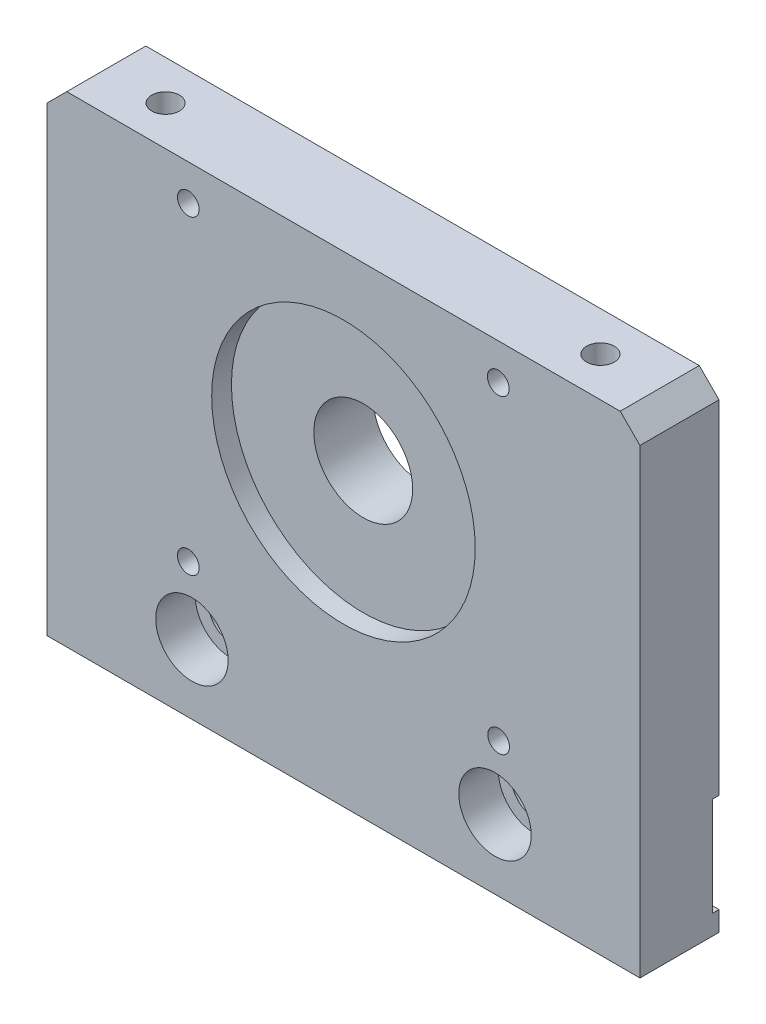
from build123d import *

# Parameters (mm, degrees)
SKETCH_1_W                   = 90
SKETCH_1_H                   = 73
EXTRUDE_1_DEPTH              = 12
SKETCH_2_R                   = 20
CUT_EXTRUDE_1_DEPTH          = 3
SKETCH_3_R                   = 7.5
CUT_EXTRUDE_2_DEPTH          = 117.232525568
CHAMFER_1_SIZE               = 3
SKETCH_4_W                   = 1
SKETCH_4_H                   = 15
CUT_EXTRUDE_3_DEPTH          = 117.50321884
HOLE_WIZARD_M6_1_D           = 7
HOLE_WIZARD_M6_1_CBORE_D     = 11
HOLE_WIZARD_M6_1_CBORE_DEPTH = 6
HOLE_WIZARD_M5_1_D           = 4.2
HOLE_WIZARD_M5_1_DEPTH       = 12.4
HOLE_WIZARD_M5_1_TIP         = 1.2618073
HOLE_WIZARD_M4_1_D           = 3.3
HOLE_WIZARD_M4_1_DEPTH       = 10.1
HOLE_WIZARD_M4_1_TIP         = 0.991420021
HOLE_WIZARD_M5_2_D           = 4.2
HOLE_WIZARD_M5_2_DEPTH       = 12.4
HOLE_WIZARD_M5_2_TIP         = 1.2618073


with BuildPart() as part:
    # 草图1 → 凸台-拉伸1 (new body)
    with BuildSketch(Plane.XY):
        with Locations((45, 36.5)):
            Rectangle(SKETCH_1_W, SKETCH_1_H)
    extrude(amount=EXTRUDE_1_DEPTH)

    # 草图2 → 切除-拉伸1 (cut)
    with BuildSketch(Plane.XY.offset(12)):
        with Locations((45, 44)):
            Circle(SKETCH_2_R)
    extrude(amount=-CUT_EXTRUDE_1_DEPTH, mode=Mode.SUBTRACT)

    # 草图3 → 切除-拉伸2 (cut, through all)
    with BuildSketch(Plane.XY.offset(9)):
        with Locations((45, 44)):
            Circle(SKETCH_3_R)
    extrude(amount=-CUT_EXTRUDE_2_DEPTH, mode=Mode.SUBTRACT)

    # 倒角1
    chamfer_1_edges = [part.edges().sort_by_distance(p)[0] for p in [
        (0, 73, 6),
        (90, 73, 6),
    ]]
    chamfer(chamfer_1_edges, length=CHAMFER_1_SIZE)

    # 草图4 → 切除-拉伸3 (cut, through all)
    with BuildSketch(Plane(origin=(90, 0, 0), x_dir=(0, 0, -1), z_dir=(1, 0, 0))):
        with Locations((-0.5, 10.5)):
            Rectangle(SKETCH_4_W, SKETCH_4_H)
    extrude(amount=-CUT_EXTRUDE_3_DEPTH, mode=Mode.SUBTRACT)

    # M6 六角凹头螺钉的柱形沉头孔1 (through all)
    with Locations(Plane.XY.offset(12)):
        with Locations((22, 10.5), (68, 10.5)):
            CounterBoreHole(HOLE_WIZARD_M6_1_D / 2, HOLE_WIZARD_M6_1_CBORE_D / 2, HOLE_WIZARD_M6_1_CBORE_DEPTH)

    # M5 螺纹孔1
    with Locations(Plane(origin=(0, 73, 0), x_dir=(-1, 0, 0), z_dir=(0, 1, 0))):
        with Locations((-12, 6), (-78, 6)):
            Hole(HOLE_WIZARD_M5_1_D / 2, depth=HOLE_WIZARD_M5_1_DEPTH)
            with Locations((0, 0, -(HOLE_WIZARD_M5_1_DEPTH + HOLE_WIZARD_M5_1_TIP / 2))):  # 118° drill point
                Cone(0, HOLE_WIZARD_M5_1_D / 2, HOLE_WIZARD_M5_1_TIP, mode=Mode.SUBTRACT)

    # M4 螺纹孔1
    with Locations(Plane.XY.offset(12)):
        with Locations((68.5, 67.5), (21.45, 67.55), (21.45, 20.45), (68.55, 20.45)):
            Hole(HOLE_WIZARD_M4_1_D / 2, depth=HOLE_WIZARD_M4_1_DEPTH)
            with Locations((0, 0, -(HOLE_WIZARD_M4_1_DEPTH + HOLE_WIZARD_M4_1_TIP / 2))):  # 118° drill point
                Cone(0, HOLE_WIZARD_M4_1_D / 2, HOLE_WIZARD_M4_1_TIP, mode=Mode.SUBTRACT)

    # M5 螺纹孔2
    with Locations(Plane.ZY):
        with Locations((6, 43)):
            Hole(HOLE_WIZARD_M5_2_D / 2, depth=HOLE_WIZARD_M5_2_DEPTH)
            with Locations((0, 0, -(HOLE_WIZARD_M5_2_DEPTH + HOLE_WIZARD_M5_2_TIP / 2))):  # 118° drill point
                Cone(0, HOLE_WIZARD_M5_2_D / 2, HOLE_WIZARD_M5_2_TIP, mode=Mode.SUBTRACT)


solid = part.part
